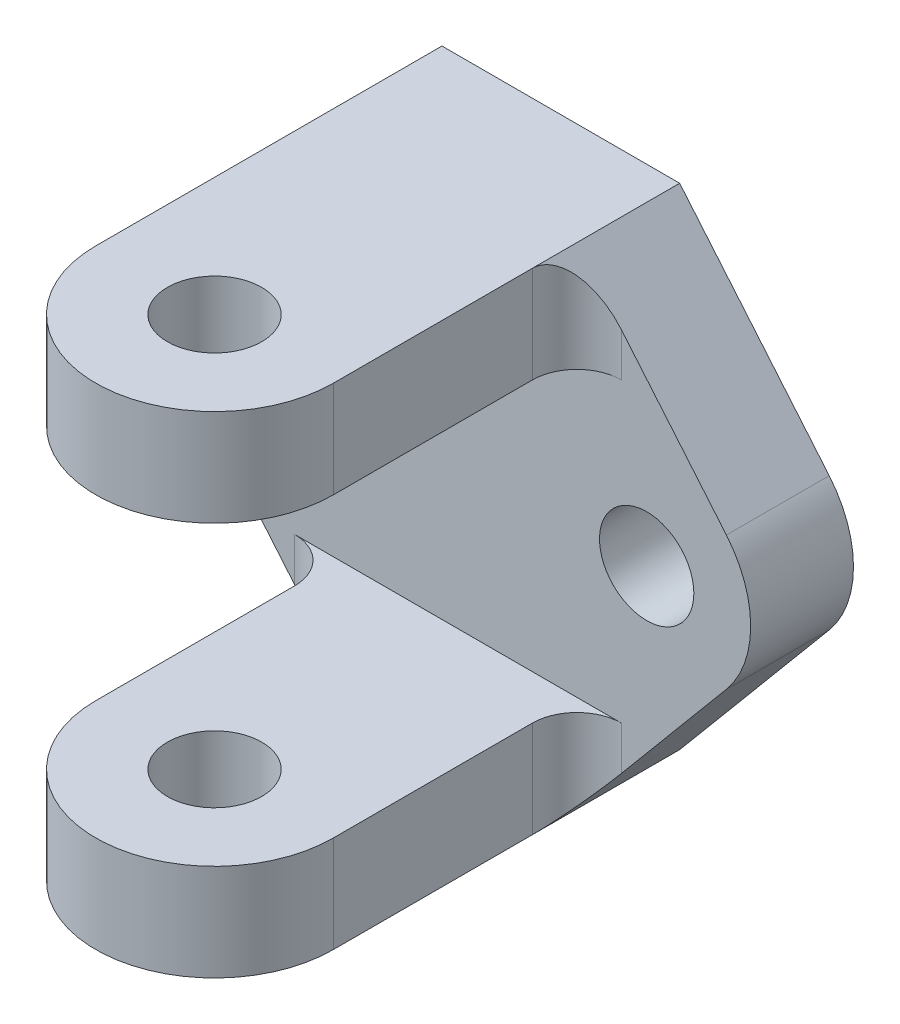
from build123d import *

# Parameters (mm, degrees)
SKETCH1_W                      = 41.4
SKETCH1_H                      = 33.02
SKETCH1_R                      = 3.175
BOSS_EXTRUDE1_DEPTH            = 9.46
SKETCH2_W                      = 41.4
SKETCH2_H                      = 6.51
BOSS_EXTRUDE2_DEPTH            = 53
CUT_EXTRUDE1_REACH             = 69.84
SKETCH4_R                      = 3.175
CUT_EXTRUDE1_DIRECTION_2_REACH = 69.84
CUT_EXTRUDE3_REACH             = 69.84
CUT_EXTRUDE3_DIRECTION_2_REACH = 69.84
CUT_EXTRUDE4_DEPTH             = 9.46
BOSS_EXTRUDE3_DEPTH            = 9.46
FILLET3_R                      = 3
CUT_EXTRUDE5_DEPTH             = 2.54


with BuildPart() as part:
    # Sketch1 → Boss-Extrude1 (new body)
    with BuildSketch(Plane.XY):
        Rectangle(SKETCH1_W, SKETCH1_H)
        with Locations((12.7, 0)):
            Circle(SKETCH1_R, mode=Mode.SUBTRACT)
        with Locations((-12.7, 0)):
            Circle(SKETCH1_R, mode=Mode.SUBTRACT)
    extrude(amount=BOSS_EXTRUDE1_DEPTH)

    # Sketch2 → Boss-Extrude2 (add)
    with BuildSketch(Plane.XY.offset(9.46)):
        with Locations((0, 13.255)):
            Rectangle(SKETCH2_W, SKETCH2_H)
        with Locations((0, -13.255)):
            Rectangle(SKETCH2_W, SKETCH2_H)
    extrude(amount=BOSS_EXTRUDE2_DEPTH)

    # Cut-Extrude1: up to this face of the body (flat: up to its plane)
    cut_extrude1_end = Plane(part.part.faces().sort_by_distance((0, -16.51, 31.23))[0])
    # Sketch4 → Cut-Extrude1 (cut, up to the picked face)
    with BuildSketch(Plane(origin=(0, 0, 0), x_dir=(1, 0, 0), z_dir=(0, 1, 0)), mode=Mode.PRIVATE) as cut_extrude1_sk1:
        with Locations(Location((0, -25.8481308, 0), (0, 0, 270))):
            Circle(SKETCH4_R)
    cut_extrude1_tool1 = split(extrude(cut_extrude1_sk1.sketch, amount=-CUT_EXTRUDE1_REACH, mode=Mode.PRIVATE), bisect_by=cut_extrude1_end, keep=Keep.BOTH, mode=Mode.PRIVATE)
    add(cut_extrude1_tool1.solids().sort_by(Axis((0, 0, 25.848131), (0, -1, 0)))[0], mode=Mode.SUBTRACT)

    # Cut-Extrude1 direction 2: up to this face of the body (flat: up to its plane)
    cut_extrude1_direction_2_end = Plane(part.part.faces().sort_by_distance((0, 16.51, 31.23))[0])
    # Sketch4 → Cut-Extrude1 direction 2 (cut, up to the picked face)
    with BuildSketch(Plane(origin=(0, 0, 0), x_dir=(1, 0, 0), z_dir=(0, 1, 0)), mode=Mode.PRIVATE) as cut_extrude1_direction_2_sk1:
        with Locations(Location((0, -25.8481308, 0), (0, 0, 270))):
            Circle(SKETCH4_R)
    cut_extrude1_direction_2_tool1 = split(extrude(cut_extrude1_direction_2_sk1.sketch, amount=CUT_EXTRUDE1_DIRECTION_2_REACH, mode=Mode.PRIVATE), bisect_by=cut_extrude1_direction_2_end, keep=Keep.BOTH, mode=Mode.PRIVATE)
    add(cut_extrude1_direction_2_tool1.solids().sort_by(Axis((0, 0, 25.848131), (0, 1, 0)))[0], mode=Mode.SUBTRACT)

    # Cut-Extrude3: up to this face of the body (flat: up to its plane)
    cut_extrude3_end = Plane(part.part.faces().sort_by_distance((0, -16.51, 31.296729805))[0])
    # Sketch6 → Cut-Extrude3 (cut, up to the picked face)
    with BuildSketch(Plane(origin=(0, 0, 0), x_dir=(1, 0, 0), z_dir=(0, 1, 0)), mode=Mode.PRIVATE) as cut_extrude3_sk1:
        with BuildLine():
            Line((-8, -25.8481308), (-8, -17.46))
            Line((-8, -17.46), (-8, -9.46))
            Line((-8, -9.46), (-16, -9.46))
            Line((-16, -9.46), (-20.7, -9.46))
            Line((-20.7, -9.46), (-20.7, -62.46))
            Line((-20.7, -62.46), (20.7, -62.46))
            Line((20.7, -62.46), (20.7, -9.46))
            Line((20.7, -9.46), (16, -9.46))
            Line((16, -9.46), (8, -9.46))
            Line((8, -9.46), (8, -17.46))
            Line((8, -17.46), (8, -25.8481308))
            ThreePointArc((8, -25.8481308), (0, -33.8481308), (-8, -25.8481308))
        make_face()
    cut_extrude3_tool1 = split(extrude(cut_extrude3_sk1.sketch, amount=-CUT_EXTRUDE3_REACH, mode=Mode.PRIVATE), bisect_by=cut_extrude3_end, keep=Keep.BOTH, mode=Mode.PRIVATE)
    add(cut_extrude3_tool1.solids().sort_by(Axis((0, 0, 38.949542), (0, -1, 0)))[0], mode=Mode.SUBTRACT)

    # Cut-Extrude3 direction 2: up to this face of the body (flat: up to its plane)
    cut_extrude3_direction_2_end = Plane(part.part.faces().sort_by_distance((0, 16.51, 31.296729805))[0])
    # Sketch6 → Cut-Extrude3 direction 2 (cut, up to the picked face)
    with BuildSketch(Plane(origin=(0, 0, 0), x_dir=(1, 0, 0), z_dir=(0, 1, 0)), mode=Mode.PRIVATE) as cut_extrude3_direction_2_sk1:
        with BuildLine():
            Line((-8, -25.8481308), (-8, -17.46))
            Line((-8, -17.46), (-8, -9.46))
            Line((-8, -9.46), (-16, -9.46))
            Line((-16, -9.46), (-20.7, -9.46))
            Line((-20.7, -9.46), (-20.7, -62.46))
            Line((-20.7, -62.46), (20.7, -62.46))
            Line((20.7, -62.46), (20.7, -9.46))
            Line((20.7, -9.46), (16, -9.46))
            Line((16, -9.46), (8, -9.46))
            Line((8, -9.46), (8, -17.46))
            Line((8, -17.46), (8, -25.8481308))
            ThreePointArc((8, -25.8481308), (0, -33.8481308), (-8, -25.8481308))
        make_face()
    cut_extrude3_direction_2_tool1 = split(extrude(cut_extrude3_direction_2_sk1.sketch, amount=CUT_EXTRUDE3_DIRECTION_2_REACH, mode=Mode.PRIVATE), bisect_by=cut_extrude3_direction_2_end, keep=Keep.BOTH, mode=Mode.PRIVATE)
    add(cut_extrude3_direction_2_tool1.solids().sort_by(Axis((0, 0, 38.949542), (0, 1, 0)))[0], mode=Mode.SUBTRACT)

    # Sketch7 → Cut-Extrude4 (cut)
    with BuildSketch(Plane.XY):
        with BuildLine():
            ThreePointArc((-12.7, -7), (-19.7, 0), (-12.7, 7))
            Line((-12.7, 7), (-8, 7))
            Line((-8, 7), (-8, 16.51))
            Line((-8, 16.51), (-20.7, 16.51))
            Line((-20.7, 16.51), (-20.7, -16.51))
            Line((-20.7, -16.51), (-8, -16.51))
            Line((-8, -16.51), (-8, -7))
            Line((-8, -7), (-12.7, -7))
        make_face()
        with BuildLine():
            Line((8, 16.51), (8, 7))
            Line((8, 7), (12.7, 7))
            ThreePointArc((12.7, 7), (19.7, 0), (12.7, -7))
            Line((12.7, -7), (8, -7))
            Line((8, -7), (8, -16.51))
            Line((8, -16.51), (20.7, -16.51))
            Line((20.7, -16.51), (20.7, 16.51))
            Line((20.7, 16.51), (8, 16.51))
        make_face()
    extrude(amount=CUT_EXTRUDE4_DEPTH, mode=Mode.SUBTRACT)

    # Sketch8 → Boss-Extrude3 (add)
    with BuildSketch(Plane.XY):
        with BuildLine():
            Line((8, -16.51), (18.065759147, -4.495400847))
            ThreePointArc((18.065759147, -4.495400847), (15.660759537, -6.343020019), (12.7, -7))
            Line((12.7, -7), (8, -7))
            Line((8, -7), (8, -16.51))
        make_face()
        with BuildLine():
            ThreePointArc((-18.065759147, -4.495400847), (-15.660759537, -6.343020019), (-12.7, -7))
            Line((-12.7, -7), (-8, -7))
            Line((-8, -7), (-8, -16.51))
            Line((-8, -16.51), (-18.065759147, -4.495400847))
        make_face()
        with BuildLine():
            Line((8, 16.51), (18.065759147, 4.495400847))
            ThreePointArc((18.065759147, 4.495400847), (15.660759537, 6.343020019), (12.7, 7))
            Line((12.7, 7), (8, 7))
            Line((8, 7), (8, 16.51))
        make_face()
        with BuildLine():
            Line((-8, 16.51), (-18.065759147, 4.495400847))
            ThreePointArc((-18.065759147, 4.495400847), (-15.660759537, 6.343020019), (-12.7, 7))
            Line((-12.7, 7), (-8, 7))
            Line((-8, 7), (-8, 16.51))
        make_face()
    extrude(amount=BOSS_EXTRUDE3_DEPTH)

    # Fillet3
    fillet3_edges = [part.edges().sort_by_distance(p)[0] for p in [
        (8, -13.255, 9.46),
        (-8, -13.255, 9.46),
        (8, 13.255, 9.46),
        (-8, 13.255, 9.46),
    ]]
    fillet(fillet3_edges, radius=FILLET3_R)

    # Sketch10 → Cut-Extrude5 (cut)
    with BuildSketch(Plane.XY):
        with BuildLine():
            Line((-8, 16.51), (-18.065759147, 4.495400847))
            ThreePointArc((-18.065759147, 4.495400847), (-19.7, 0), (-18.065759147, -4.495400847))
            Line((-18.065759147, -4.495400847), (-8, -16.51))
            Line((-8, -16.51), (8, -16.51))
            Line((8, -16.51), (18.065759147, -4.495400847))
            ThreePointArc((18.065759147, -4.495400847), (19.7, 0), (18.065759147, 4.495400847))
            Line((18.065759147, 4.495400847), (8, 16.51))
            Line((8, 16.51), (-8, 16.51))
        make_face()
    extrude(amount=CUT_EXTRUDE5_DEPTH, mode=Mode.SUBTRACT)


solid = part.part
